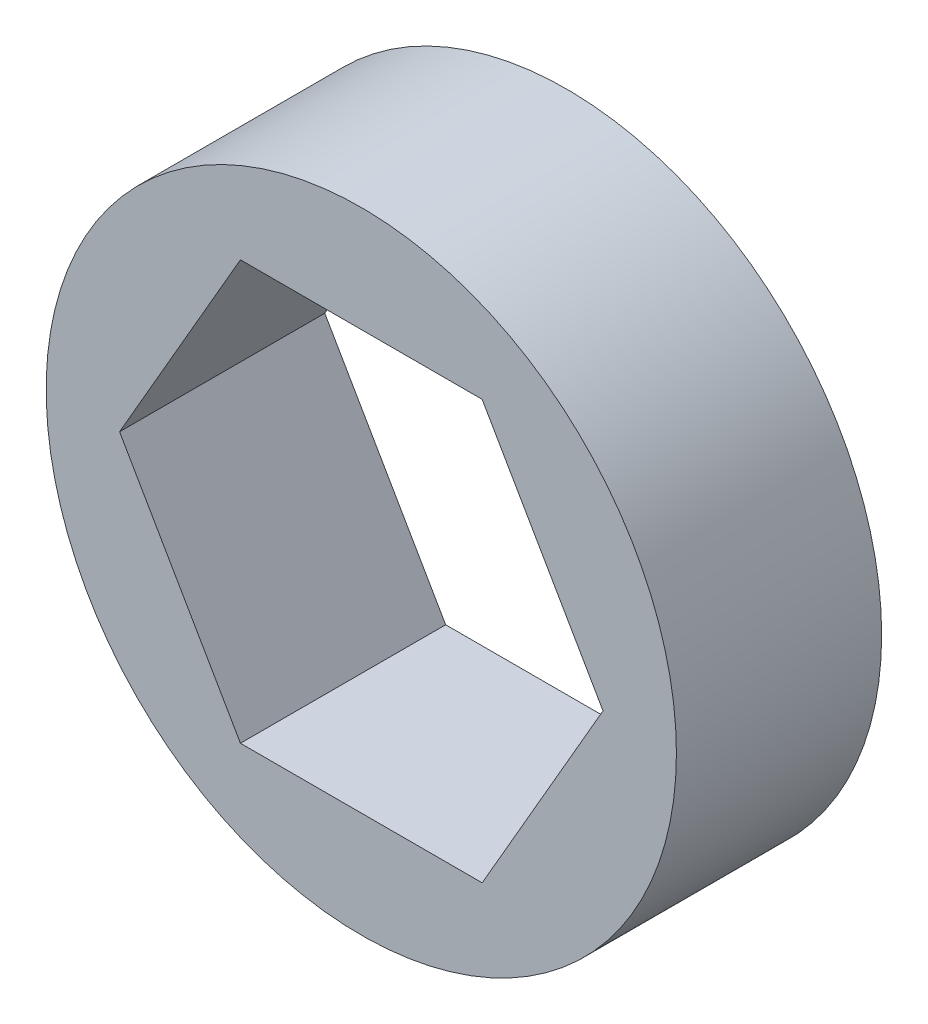
from build123d import *

# Parameters (mm, degrees)
SKETCH1_R           = 9.75
BOSS_EXTRUDE1_DEPTH = 3.175


with BuildPart() as part:
    # Sketch1 → Boss-Extrude1 (new, symmetric)
    with BuildSketch(Plane.XY):
        Circle(SKETCH1_R)
        Polygon((-3.739497694, 6.477), (3.739497694, 6.477), (7.478995387, 0), (3.739497694, -6.477), (-3.739497694, -6.477), (-7.478995387, 0), align=None, mode=Mode.SUBTRACT)
    extrude(amount=BOSS_EXTRUDE1_DEPTH, both=True)


solid = part.part
